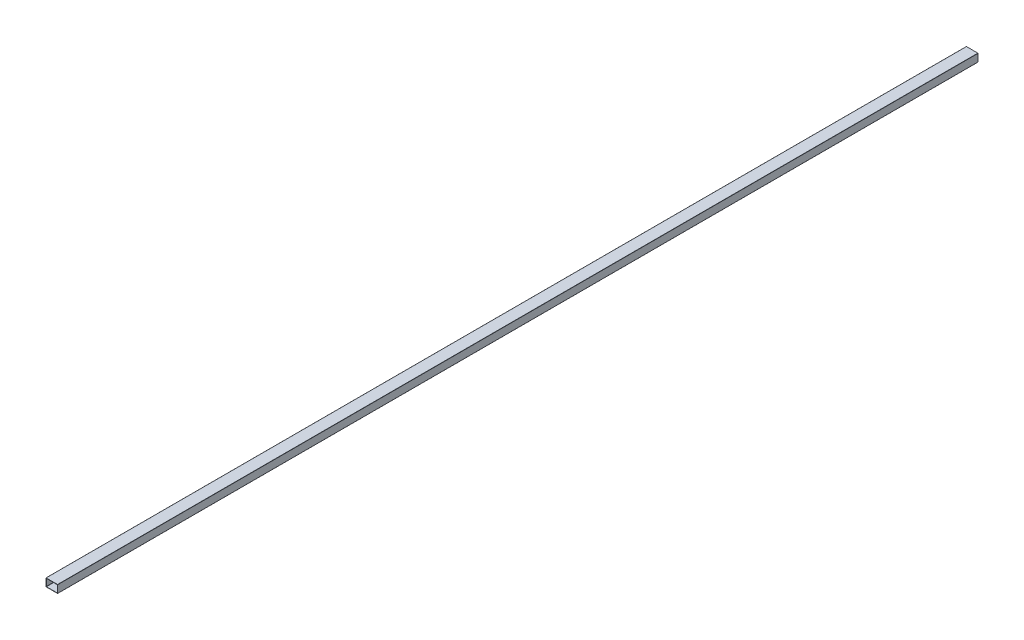
from build123d import *

# Parameters (mm, degrees)
CROQUIS1_W              = 76.2
CROQUIS1_H              = 50.8
CROQUIS1_W_2            = 72.42
CROQUIS1_H_2            = 47.02
SALIENTE_EXTRUIR1_DEPTH = 6000
REDONDEO1_R             = 1


with BuildPart() as part:
    # Croquis1 → Saliente-Extruir1 (new body)
    with BuildSketch(Plane.XY):
        Rectangle(CROQUIS1_W, CROQUIS1_H)
        Rectangle(CROQUIS1_W_2, CROQUIS1_H_2, mode=Mode.SUBTRACT)
    extrude(amount=-SALIENTE_EXTRUIR1_DEPTH)

    # Redondeo1
    redondeo1_edges = [part.edges().sort_by_distance(p)[0] for p in [
        (36.21, -23.51, -3000),
        (-36.21, -23.51, -3000),
        (-36.21, 23.51, -3000),
        (36.21, 23.51, -3000),
        (38.1, -25.4, -3000),
        (-38.1, -25.4, -3000),
        (-38.1, 25.4, -3000),
        (38.1, 25.4, -3000),
    ]]
    fillet(redondeo1_edges, radius=REDONDEO1_R)


solid = part.part
